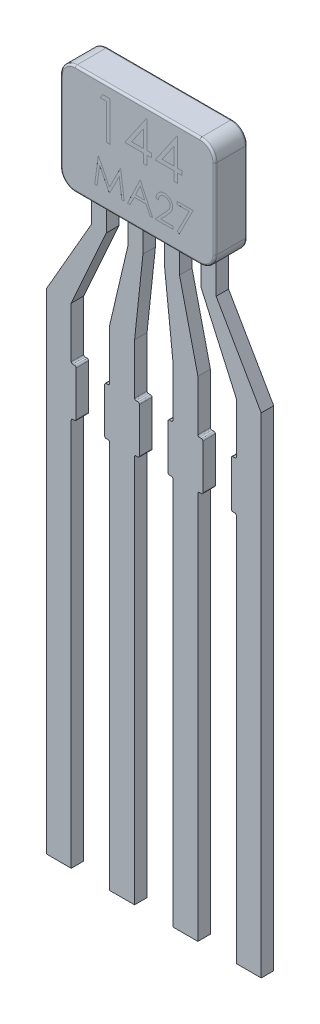
from build123d import *

# Parameters (mm, degrees)
BOSS_EXTRUDE1_DEPTH = 0.325
FILLET1_R           = 0.04
SKETCH2_W           = 2.5
SKETCH2_H           = 0.49680622
CUT_EXTRUDE1_DEPTH  = 0.4
BOSS_EXTRUDE2_DEPTH = 0.25
CUT_EXTRUDE2_DEPTH  = 0.0001


with BuildPart() as part:
    # Sketch1 → Boss-Extrude1 (new, symmetric)
    with BuildSketch(Plane.XY):
        with BuildLine():
            Line((-1.25, 1.1), (1.25, 1.1))
            ThreePointArc((1.25, 1.1), (1.462132034, 1.012132034), (1.55, 0.8))
            Line((1.55, 0.8), (1.55, -0.8))
            ThreePointArc((1.55, -0.8), (1.462132034, -1.012132034), (1.25, -1.1))
            Line((1.25, -1.1), (-1.25, -1.1))
            ThreePointArc((-1.25, -1.1), (-1.462132034, -1.012132034), (-1.55, -0.8))
            Line((-1.55, -0.8), (-1.55, 0.8))
            ThreePointArc((-1.55, 0.8), (-1.462132034, 1.012132034), (-1.25, 1.1))
        make_face()
    extrude(amount=BOSS_EXTRUDE1_DEPTH, both=True)

    # Fillet1
    fillet1_edges = [part.edges().sort_by_distance(p)[0] for p in [
        (1.462132034, -1.012132034, 0.325),
        (0, -1.1, -0.325),
        (-1.462132034, -1.012132034, -0.325),
        (1.55, 0, 0.325),
        (1.462132034, 1.012132034, 0.325),
        (0, 1.1, 0.325),
        (-1.462132034, 1.012132034, 0.325),
        (-1.55, 0, 0.325),
        (-1.462132034, -1.012132034, 0.325),
        (0, -1.1, 0.325),
        (-1.55, 0, -0.325),
        (-1.462132034, 1.012132034, -0.325),
        (0, 1.1, -0.325),
        (1.462132034, 1.012132034, -0.325),
        (1.55, 0, -0.325),
        (1.462132034, -1.012132034, -0.325),
    ]]
    fillet(fillet1_edges, radius=FILLET1_R)

    # Sketch2 → Cut-Extrude1 (cut)
    with BuildSketch(Plane.XZ.offset(1.1)):
        Rectangle(SKETCH2_W, SKETCH2_H)
    extrude(amount=-CUT_EXTRUDE1_DEPTH, mode=Mode.SUBTRACT)

    # Sketch3 → Boss-Extrude2 (add)
    with BuildSketch(Plane.XY.offset(-0.24840311)):
        with BuildLine():
            Line((-1.25, -0.7), (-1.25, -1.813567349))
            Line((-1.25, -1.813567349), (-2.155, -3.385995645))
            Line((-2.155, -3.385995645), (-2.155, -13.2))
            Line((-2.155, -13.2), (-1.655, -13.2))
            Line((-1.655, -13.2), (-1.655, -5.417330503))
            ThreePointArc((-1.655, -5.417330503), (-1.646213203, -5.3961173), (-1.625, -5.387330503))
            Line((-1.625, -5.387330503), (-1.585, -5.387330503))
            ThreePointArc((-1.585, -5.387330503), (-1.563786797, -5.378543706), (-1.555, -5.357330503))
            Line((-1.555, -5.357330503), (-1.555, -4.460635053))
            ThreePointArc((-1.555, -4.460635053), (-1.563786797, -4.439421849), (-1.585, -4.430635053))
            Line((-1.585, -4.430635053), (-1.625, -4.430635053))
            ThreePointArc((-1.625, -4.430635053), (-1.646213203, -4.421848256), (-1.655, -4.400635053))
            Line((-1.655, -4.400635053), (-1.655, -3.385995645))
            Line((-1.655, -3.385995645), (-0.95, -1.813567349))
            Line((-0.95, -1.813567349), (-0.95, -0.7))
            Line((-0.95, -0.7), (-1.25, -0.7))
        make_face()
        with BuildLine():
            Line((-0.5166, -0.7), (-0.5166, -1.813567349))
            Line((-0.5166, -1.813567349), (-0.885, -3.385995645))
            Line((-0.885, -3.385995645), (-0.885, -4.400635053))
            ThreePointArc((-0.885, -4.400635053), (-0.893786797, -4.421848256), (-0.915, -4.430635053))
            Line((-0.915, -4.430635053), (-0.955, -4.430635053))
            ThreePointArc((-0.955, -4.430635053), (-0.976213203, -4.439421849), (-0.985, -4.460635053))
            Line((-0.985, -4.460635053), (-0.985, -5.357330503))
            ThreePointArc((-0.985, -5.357330503), (-0.976213203, -5.378543706), (-0.955, -5.387330503))
            Line((-0.955, -5.387330503), (-0.915, -5.387330503))
            ThreePointArc((-0.915, -5.387330503), (-0.893786797, -5.3961173), (-0.885, -5.417330503))
            Line((-0.885, -5.417330503), (-0.885, -13.2))
            Line((-0.885, -13.2), (-0.385, -13.2))
            Line((-0.385, -13.2), (-0.385, -5.417330503))
            ThreePointArc((-0.385, -5.417330503), (-0.376213203, -5.3961173), (-0.355, -5.387330503))
            Line((-0.355, -5.387330503), (-0.315, -5.387330503))
            ThreePointArc((-0.315, -5.387330503), (-0.293786797, -5.378543706), (-0.285, -5.357330503))
            Line((-0.285, -5.357330503), (-0.285, -4.460635053))
            ThreePointArc((-0.285, -4.460635053), (-0.293786797, -4.439421849), (-0.315, -4.430635053))
            Line((-0.315, -4.430635053), (-0.355, -4.430635053))
            ThreePointArc((-0.355, -4.430635053), (-0.376213203, -4.421848256), (-0.385, -4.400635053))
            Line((-0.385, -4.400635053), (-0.385, -3.385995645))
            Line((-0.385, -3.385995645), (-0.2166, -1.813567349))
            Line((-0.2166, -1.813567349), (-0.2166, -0.7))
            Line((-0.2166, -0.7), (-0.5166, -0.7))
        make_face()
    boss_extrude2 = extrude(amount=BOSS_EXTRUDE2_DEPTH)

    # Mirror1: Boss-Extrude2 across plane
    add(boss_extrude2.mirror(Plane(origin=(0, 0, 0), x_dir=(0, 0, 1), z_dir=(1, 0, 0))))

    # Sketch4 → Cut-Extrude2 (cut)
    # profile 1 of 7: a face of its own
    with BuildSketch(Plane.XY.offset(0.325)):
        Polygon((-0.70166504, 0.876514531), (-0.554903972, 0.876514531), (-0.554903972, 0.082764531), (-0.626137947, 0.082764531), (-0.626137947, 0.795104275), (-0.748253331, 0.795104275), align=None)
    # profile 2 of 7: a face of its own
    with BuildSketch(Plane.XY.offset(0.325)):
        Polygon((0.173495216, 0.896867096), (0.187964617, 0.896867096), (0.187964617, 0.347347865), (0.279551156, 0.347347865), (0.279551156, 0.265937608), (0.187964617, 0.265937608), (0.187964617, 0.082764531), (0.116730643, 0.082764531), (0.116730643, 0.265937608), (-0.259791793, 0.265937608), align=None)
        Polygon((0.116730643, 0.347347865), (0.116730643, 0.692069419), (-0.119867915, 0.347347865), align=None, mode=Mode.SUBTRACT)
    # profile 3 of 7: a face of its own
    with BuildSketch(Plane.XY.offset(0.325)):
        Polygon((0.784072139, 0.896867096), (0.79854154, 0.896867096), (0.79854154, 0.347347865), (0.890128079, 0.347347865), (0.890128079, 0.265937608), (0.79854154, 0.265937608), (0.79854154, 0.082764531), (0.727307566, 0.082764531), (0.727307566, 0.265937608), (0.35078513, 0.265937608), align=None)
        Polygon((0.727307566, 0.347347865), (0.727307566, 0.692069419), (0.490709008, 0.347347865), align=None, mode=Mode.SUBTRACT)
    # profile 4 of 7: a face of its own
    with BuildSketch(Plane.XY.offset(0.325)):
        Polygon((-0.860192434, -0.761065582), (-0.790336498, -0.231898915), (-0.78355231, -0.231898915), (-0.565080255, -0.66608695), (-0.347138214, -0.231898915), (-0.340248023, -0.231898915), (-0.269968075, -0.761065582), (-0.317669397, -0.761065582), (-0.368338802, -0.380303029), (-0.559356096, -0.761065582), (-0.570062393, -0.761065582), (-0.761821708, -0.379455005), (-0.812385109, -0.761065582), align=None)
    # profile 5 of 7: a face of its own
    with BuildSketch(Plane.XY.offset(0.325)):
        Polygon((0.055672951, -0.231898915), (0.29990372, -0.761065582), (0.248280289, -0.761065582), (0.170050121, -0.591460881), (-0.069834528, -0.591460881), (-0.150290758, -0.761065582), (-0.202126195, -0.761065582), (0.048888763, -0.231898915), align=None)
        Polygon((0.051750842, -0.335039774), (-0.044075814, -0.537187377), (0.145033427, -0.537187377), align=None, mode=Mode.SUBTRACT)
    # profile 6 of 7: a face of its own
    with BuildSketch(Plane.XY.offset(0.325)):
        with BuildLine():
            Line((0.415234916, -0.394719428), (0.3677456, -0.394719428))
            add(Edge.make_bspline(
                [(0.3677456, -0.394719428), (0.36805511, -0.388419187), (0.36866298, -0.376045681), (0.371509638, -0.358005042), (0.375582842, -0.340761043), (0.381341907, -0.324452139), (0.388494165, -0.308934129), (0.397071205, -0.294268651), (0.407230276, -0.280511649), (0.418752008, -0.267790658), (0.431265838, -0.256120632), (0.444768045, -0.246042994), (0.45895652, -0.237528299), (0.473788215, -0.230410063), (0.489430467, -0.225067015), (0.505741327, -0.221102553), (0.522792459, -0.21871732), (0.534409938, -0.218460933), (0.540318383, -0.218330539)],
                knots=[0, 0, 0, 0, 1.10065271, 2.161652631, 3.183658789, 4.190468796, 5.17591951, 6.163126047, 7.15150782, 8.156236427, 9.156009102, 10.134482811, 11.092018607, 12.041330605, 13.001268258, 13.972401359, 14.968799086, 16, 16, 16, 16], degree=3))
            add(Edge.make_bspline(
                [(0.540318383, -0.218330539), (0.546120783, -0.218466377), (0.55752229, -0.218733294), (0.574162618, -0.221025498), (0.590003947, -0.224615605), (0.605015312, -0.229652579), (0.619076943, -0.236423557), (0.632294475, -0.244557233), (0.644825264, -0.253964279), (0.656105099, -0.265039558), (0.666462868, -0.276863014), (0.675398567, -0.289485589), (0.683050795, -0.302522636), (0.68942917, -0.316073567), (0.694124563, -0.330265972), (0.697689363, -0.344893228), (0.699704341, -0.360106741), (0.70001359, -0.370403804), (0.700170814, -0.375638899)],
                knots=[0, 0, 0, 0, 1.111607364, 2.184268762, 3.212621178, 4.221274766, 5.211760367, 6.196651075, 7.1921475, 8.207485113, 9.220403448, 10.201281604, 11.166441695, 12.114753415, 13.065576456, 14.026450734, 14.996634279, 16, 16, 16, 16], degree=3))
            add(Edge.make_bspline(
                [(0.700170814, -0.375638899), (0.699914809, -0.383009108), (0.699407291, -0.397620188), (0.69506595, -0.419091482), (0.688285585, -0.439894297), (0.680121699, -0.456636722), (0.671885984, -0.470127977), (0.664464421, -0.481235745), (0.655776288, -0.493195739), (0.645695135, -0.505967908), (0.634429498, -0.519652294), (0.621877338, -0.534240633), (0.607949144, -0.549582198), (0.598173395, -0.560060545), (0.593107846, -0.565490161)],
                knots=[0, 0, 0, 0, 1.184426356, 2.348067706, 3.509069118, 4.696110526, 5.333549288, 6.050745305, 6.844228056, 7.710549037, 8.667450064, 9.695053472, 10.805634456, 12, 12, 12, 12], degree=3))
            Line((0.593107846, -0.565490161), (0.460710177, -0.706792078))
            Line((0.460710177, -0.706792078), (0.706955002, -0.706792078))
            Line((0.706955002, -0.706792078), (0.706955002, -0.761065582))
            Line((0.706955002, -0.761065582), (0.347393036, -0.761065582))
            Line((0.347393036, -0.761065582), (0.552614724, -0.542063512))
            add(Edge.make_bspline(
                [(0.552614724, -0.542063512), (0.55761125, -0.536847697), (0.567208553, -0.526829183), (0.580782824, -0.512202569), (0.592974671, -0.498633293), (0.603863015, -0.486146993), (0.613211652, -0.47456103), (0.621507811, -0.46425064), (0.628154989, -0.454762765), (0.635369103, -0.443765077), (0.642356217, -0.4303375), (0.648360347, -0.41392824), (0.652021401, -0.397036144), (0.652460585, -0.385620955), (0.652681498, -0.379879017)],
                knots=[0, 0, 0, 0, 1.329631726, 2.553950428, 3.673215718, 4.687767853, 5.603093632, 6.413772471, 7.123043292, 7.734684054, 8.834405432, 9.900288307, 10.943827018, 12, 12, 12, 12], degree=3))
            add(Edge.make_bspline(
                [(0.652681498, -0.379879017), (0.652585379, -0.376268377), (0.652395949, -0.369152499), (0.65072413, -0.358719485), (0.648197661, -0.348655519), (0.644577366, -0.338929645), (0.639798728, -0.329639647), (0.633981919, -0.320774219), (0.627270565, -0.312203387), (0.619506742, -0.304167115), (0.610977857, -0.29680698), (0.601967774, -0.290287029), (0.592435199, -0.284838259), (0.582420323, -0.280371563), (0.571951068, -0.276867666), (0.561007184, -0.274439762), (0.54961891, -0.272915387), (0.541842655, -0.272709137), (0.537880316, -0.272604044)],
                knots=[0, 0, 0, 0, 0.991446411, 1.95395049, 2.89581595, 3.838931463, 4.798493298, 5.75982156, 6.748411868, 7.785213223, 8.824556874, 9.840280684, 10.836137867, 11.835679398, 12.848801643, 13.863922112, 14.911575587, 16, 16, 16, 16], degree=3))
            add(Edge.make_bspline(
                [(0.537880316, -0.272604044), (0.533742106, -0.27271215), (0.525615347, -0.272924452), (0.513683541, -0.274409545), (0.502301048, -0.276971595), (0.491439237, -0.280475688), (0.481079728, -0.28492954), (0.471272902, -0.290476982), (0.462040775, -0.297096629), (0.453365991, -0.304601808), (0.445373461, -0.312957743), (0.438351135, -0.322272583), (0.432215219, -0.332376252), (0.42686168, -0.343241487), (0.422514094, -0.35496688), (0.419191963, -0.367510807), (0.416563237, -0.380818802), (0.415685044, -0.390008928), (0.415234916, -0.394719428)],
                knots=[0, 0, 0, 0, 1.031018746, 2.02475058, 2.990194455, 3.934040569, 4.864654155, 5.795059489, 6.735614925, 7.690564532, 8.649604399, 9.611025574, 10.590972636, 11.591080095, 12.624614302, 13.701020113, 14.821632451, 16, 16, 16, 16], degree=3))
        make_face()
    # profile 7 of 7: a face of its own
    with BuildSketch(Plane.XY.offset(0.325)):
        Polygon((0.788365258, -0.231898915), (1.114006284, -0.231898915), (0.835854575, -0.774633958), (0.794831438, -0.752055332), (1.033656057, -0.28617242), (0.788365258, -0.28617242), align=None)
    extrude(amount=-CUT_EXTRUDE2_DEPTH, mode=Mode.SUBTRACT)


solid = part.part
